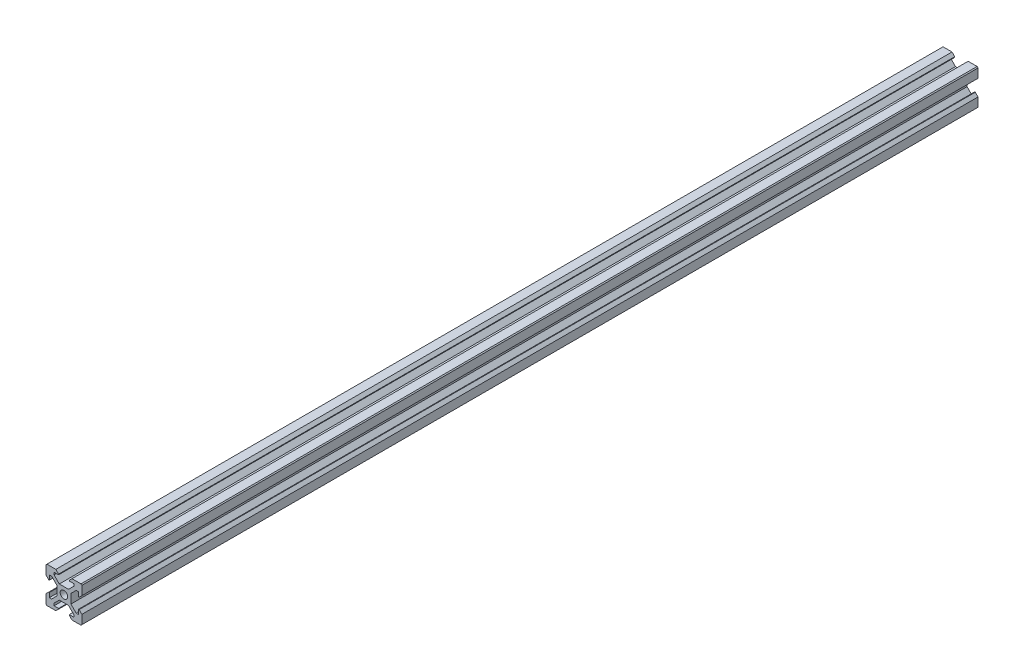
from build123d import *

# Parameters (mm, degrees)
BOSS_EXTRUDE1_DEPTH = 500
CHAMFER2_SIZE       = 0.5
CHAMFER2_SIZE2      = 0.353553391
CHAMFER1_SIZE       = 0.5


with BuildPart() as part:
    # Sketch1 → Boss-Extrude1 (new body)
    with BuildSketch(Plane.XY):
        with BuildLine():
            Line((5.5, 6.829360749), (2.570639251, 3.9))
            Line((2.570639251, 3.9), (0, 3.9))
            Line((0, 3.9), (0, 2.1))
            ThreePointArc((0, 2.1), (0.803635208, 1.940147018), (1.48492424, 1.48492424))
            Line((1.48492424, 1.48492424), (10, 10))
            Line((10, 10), (4.5, 10))
            Line((4.5, 10), (2.62, 8.12))
            Line((2.62, 8.12), (5.5, 8.12))
            Line((5.5, 8.12), (5.5, 6.829360749))
        make_face()
    extrude(amount=BOSS_EXTRUDE1_DEPTH)

    # Chamfer2
    chamfer2_edges = [part.edges().sort_by_distance(p)[0] for p in [
        (2.62, 8.12, 250),
    ]]
    chamfer2_side = [part.faces().sort_by_distance(p)[0] for p in [
        (3.56, 9.06, 250),
    ]]
    chamfer(chamfer2_edges, length=CHAMFER2_SIZE, length2=CHAMFER2_SIZE2, reference=chamfer2_side[0])

    # Mirror1: part across plane


with BuildPart() as part_1:
    add(part.part)
    add(part.part.mirror(Plane(origin=(10, 10, 500), x_dir=(0, 0, 1), z_dir=(-0.707106781186544, 0.7071067811865511, 0))))

    # Chamfer1
    chamfer1_edges = [part_1.edges().sort_by_distance(p)[0] for p in [
        (10, 10, 250),
    ]]
    chamfer(chamfer1_edges, length=CHAMFER1_SIZE)

    # Mirror4: part across plane


with BuildPart() as part_2:
    add(part_1.part)
    add(part_1.part.mirror(Plane(origin=(0, 3.9, 500), x_dir=(0, 0, 1), z_dir=(1, 0, 0))))

    # Mirror5: part across plane


with BuildPart() as part_3:
    add(part_2.part)
    add(part_2.part.mirror(Plane(origin=(-3.9, 0, 500), x_dir=(0, 0, 1), z_dir=(0, 1, 0))))


solid = part_3.part
